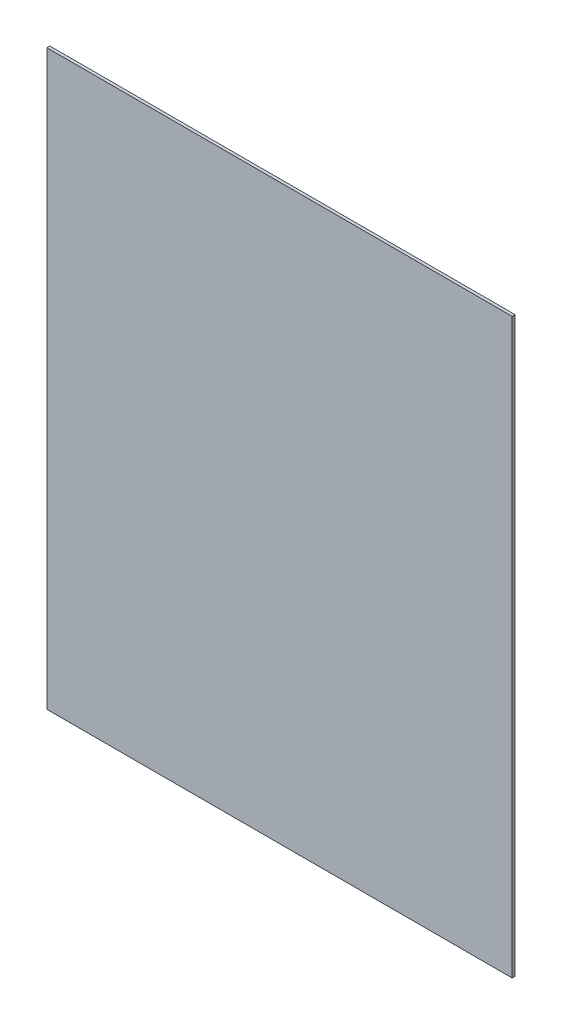
from build123d import *

# Parameters (mm, degrees)
SKETCH1_W           = 28.5
SKETCH1_H           = 35.1
BOSS_EXTRUDE1_DEPTH = 0.18


with BuildPart() as part:
    # Sketch1 → Boss-Extrude1 (new body)
    with BuildSketch(Plane.XY):
        Rectangle(SKETCH1_W, SKETCH1_H)
    extrude(amount=BOSS_EXTRUDE1_DEPTH)


solid = part.part
